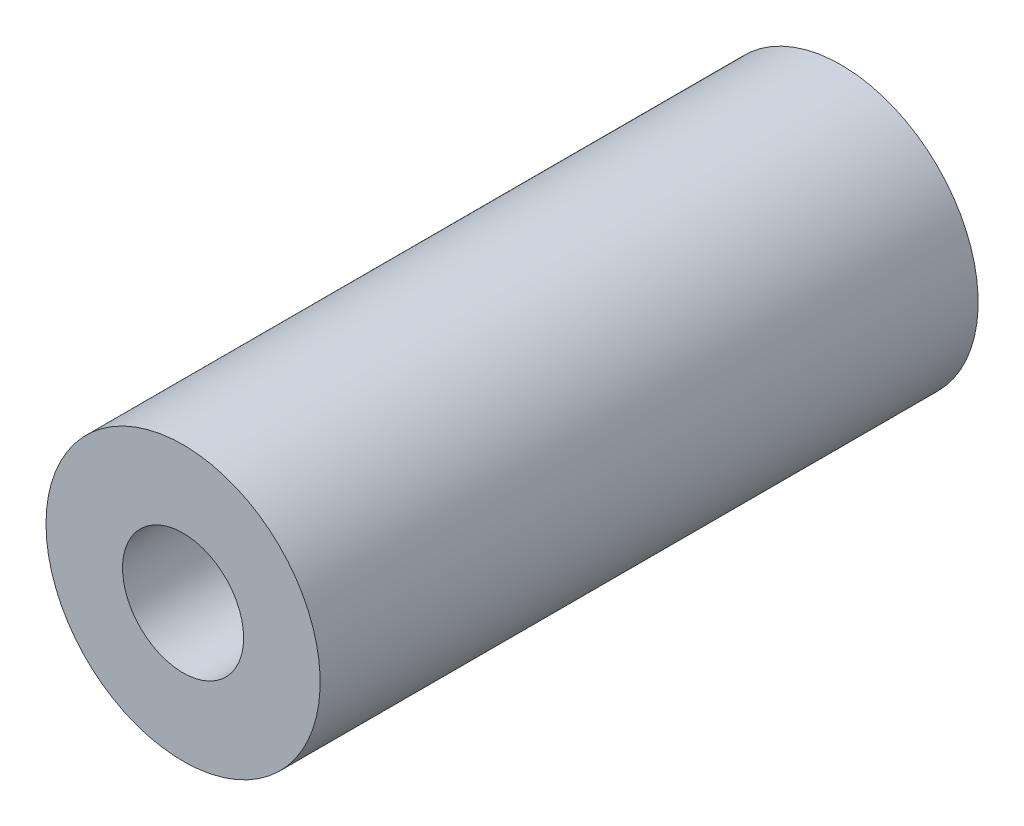
from build123d import *

# Parameters (mm, degrees)
SKETCH1_R                       = 3.96875
BOSS_EXTRUDE1_DEPTH             = 9.525
F_6_32_TAPPED_HOLE1_D           = 2.7051
F_6_32_TAPPED_HOLE1_DEPTH       = 9.398
F_6_32_TAPPED_HOLE1_CBORE_D     = 3.5052
F_6_32_TAPPED_HOLE1_CBORE_DEPTH = 7.112
F_6_32_TAPPED_HOLE1_TIP         = 0.81269403
F_6_32_TAPPED_HOLE2_D           = 2.7051
F_6_32_TAPPED_HOLE2_DEPTH       = 9.398
F_6_32_TAPPED_HOLE2_CBORE_D     = 3.5052
F_6_32_TAPPED_HOLE2_CBORE_DEPTH = 7.112
F_6_32_TAPPED_HOLE2_TIP         = 0.81269403


with BuildPart() as part:
    # Sketch1 → Boss-Extrude1 (new, symmetric)
    with BuildSketch(Plane.XY):
        with Locations(Location((0, 0, 0), (0, 0, 180))):
            Circle(SKETCH1_R)
    extrude(amount=BOSS_EXTRUDE1_DEPTH, both=True)

    # #6-32 Tapped Hole1
    with Locations(Plane(origin=(0, 0, -9.525), x_dir=(-1, 0, 0), z_dir=(0, 0, -1))):
        with Locations((0, 0)):
            CounterBoreHole(F_6_32_TAPPED_HOLE1_D / 2, F_6_32_TAPPED_HOLE1_CBORE_D / 2, F_6_32_TAPPED_HOLE1_CBORE_DEPTH, depth=F_6_32_TAPPED_HOLE1_DEPTH)
            with Locations((0, 0, -(F_6_32_TAPPED_HOLE1_DEPTH + F_6_32_TAPPED_HOLE1_TIP / 2))):  # 118° drill point
                Cone(0, F_6_32_TAPPED_HOLE1_D / 2, F_6_32_TAPPED_HOLE1_TIP, mode=Mode.SUBTRACT)

    # #6-32 Tapped Hole2
    with Locations(Plane.XY.offset(9.525)):
        with Locations((0, 0)):
            CounterBoreHole(F_6_32_TAPPED_HOLE2_D / 2, F_6_32_TAPPED_HOLE2_CBORE_D / 2, F_6_32_TAPPED_HOLE2_CBORE_DEPTH, depth=F_6_32_TAPPED_HOLE2_DEPTH)
            with Locations((0, 0, -(F_6_32_TAPPED_HOLE2_DEPTH + F_6_32_TAPPED_HOLE2_TIP / 2))):  # 118° drill point
                Cone(0, F_6_32_TAPPED_HOLE2_D / 2, F_6_32_TAPPED_HOLE2_TIP, mode=Mode.SUBTRACT)


solid = part.part
